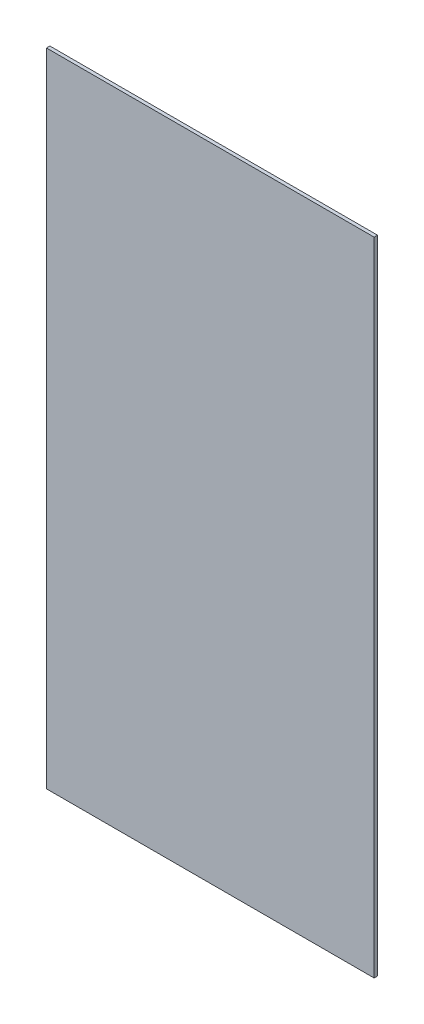
from build123d import *

# Parameters (mm, degrees)
SKETCH_1_W      = 1200
SKETCH_1_H      = 2350
EXTRUDE_1_DEPTH = 12.5


with BuildPart() as part:
    # Эскиз1 → Бобышка-Вытянуть1 (new body)
    with BuildSketch(Plane.XY):
        with Locations((-600, 1175)):
            Rectangle(SKETCH_1_W, SKETCH_1_H)
    extrude(amount=-EXTRUDE_1_DEPTH)


solid = part.part
